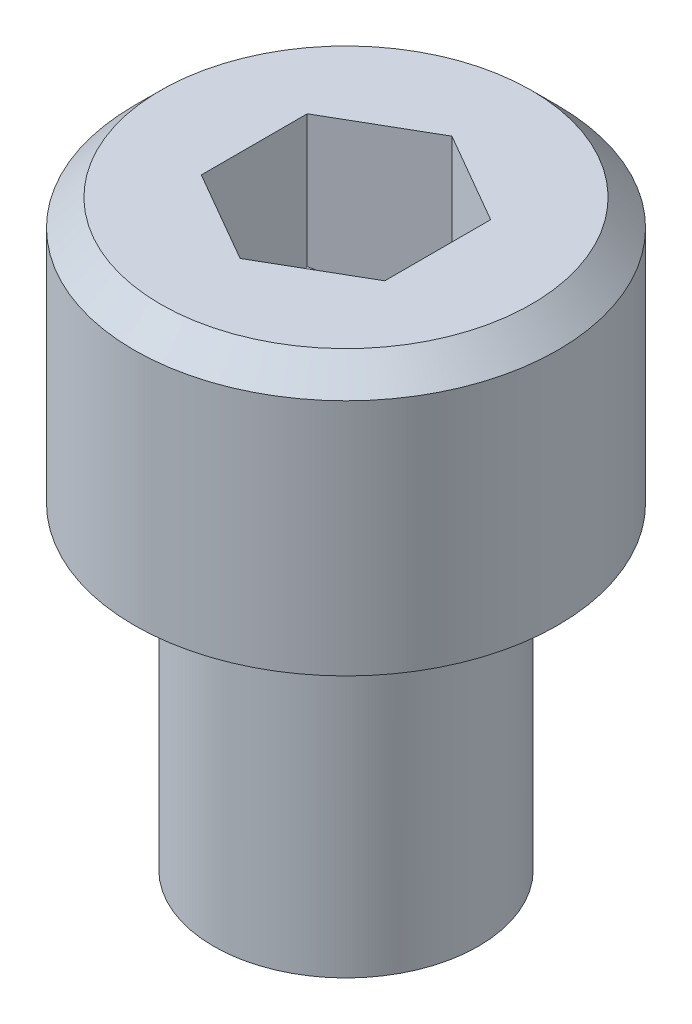
from build123d import *

# Parameters (mm, degrees)
CROQUIS4_R              = 8
SALIENTE_EXTRUIR3_DEPTH = 10
CHAFL_N2_SIZE           = 1
CROQUIS6_6_R            = 5
SALIENTE_EXTRUIR8_DEPTH = 12


with BuildPart() as part:
    # Croquis4 → Saliente-Extruir3 (new body)
    with BuildSketch(Plane(origin=(0, 0, 0), x_dir=(1, 0, 0), z_dir=(0, 1, 0))):
        Circle(CROQUIS4_R)
        Polygon((0, 4), (-3.464101615, 2), (-3.464101615, -2), (0, -4), (3.464101615, -2), (3.464101615, 2), align=None, mode=Mode.SUBTRACT)
    extrude(amount=SALIENTE_EXTRUIR3_DEPTH)

    # Chaflán2
    chafl_n2_edges = [part.edges().sort_by_distance(p)[0] for p in [
        (-8, 10, 0),
    ]]
    chamfer(chafl_n2_edges, length=CHAFL_N2_SIZE)

    # Croquis5 → Revolución2 (revolve)
    with BuildSketch(Plane.XY):
        Polygon((0, 0), (0, 2.690598923), (4, 5), (8, 5), (8, 0), align=None)
    revolve(axis=Axis((0, 0, 0), (0, 1, 0)))

    # Croquis6<6> → Saliente-Extruir8 (add)
    with BuildSketch(Plane.XZ):
        Circle(CROQUIS6_6_R)
    extrude(amount=SALIENTE_EXTRUIR8_DEPTH)


solid = part.part
